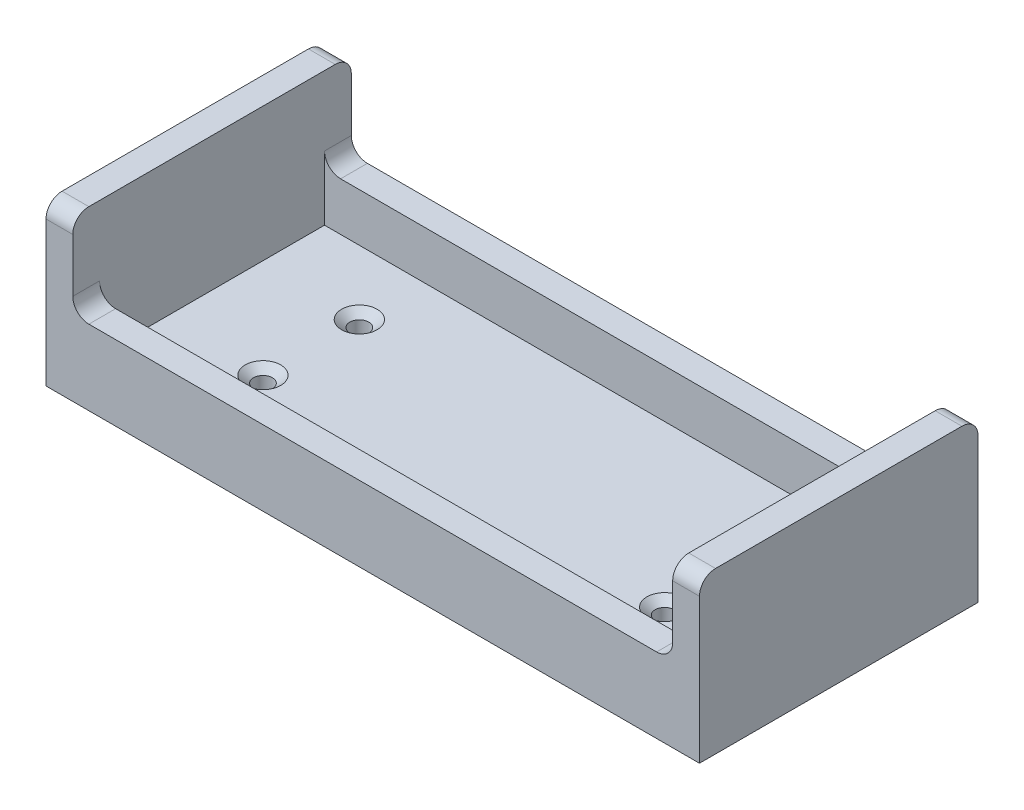
from build123d import *

# Parameters (mm, degrees)
BOSS_EXTRUDE1_DEPTH                               = 38.1
BOSS_EXTRUDE1_2_DEPTH                             = 38.1
SKETCH1_4_W                                       = 142.24
SKETCH1_4_H                                       = 53.34
BOSS_EXTRUDE2_DEPTH                               = 6.35
SKETCH1_5_W                                       = 142.24
SKETCH1_5_H                                       = 6.35
BOSS_EXTRUDE3_DEPTH                               = 17.78
FILLET1_R                                         = 3.81
CSK_FOR_8_FLAT_HEAD_MACHINE_SCREW_100_D           = 4.4958
CSK_FOR_8_FLAT_HEAD_MACHINE_SCREW_100_CSINK_D     = 8.4328
CSK_FOR_8_FLAT_HEAD_MACHINE_SCREW_100_CSINK_ANGLE = 100


with BuildPart() as part:
    # Sketch1 → Boss-Extrude1 (new body)
    with BuildSketch(Plane(origin=(0, 0, 0), x_dir=(1, 0, 0), z_dir=(0, 1, 0))):
        Polygon((72.784549316, 28.417821782), (72.784549316, 22.067821782), (72.784549316, -31.272178218), (72.784549316, -37.622178218), (79.134549316, -37.622178218), (79.134549316, 28.417821782), align=None)
    extrude(amount=BOSS_EXTRUDE1_DEPTH)



with BuildPart() as body_2:
    # Sketch1 → Boss-Extrude1 2 (new body)
    with BuildSketch(Plane(origin=(0, 0, 0), x_dir=(1, 0, 0), z_dir=(0, 1, 0))):
        Polygon((-69.455450684, -31.272178218), (-69.455450684, 22.067821782), (-69.455450684, 28.417821782), (-75.805450684, 28.417821782), (-75.805450684, -37.622178218), (-69.455450684, -37.622178218), align=None)
    extrude(amount=BOSS_EXTRUDE1_2_DEPTH)


with BuildPart() as part_1:
    add(part.part)

    add(body_2.part)  # Boss-Extrude2 merges body 2
    # Sketch1<4> → Boss-Extrude2 (add)
    with BuildSketch(Plane(origin=(0, 0, 0), x_dir=(1, 0, 0), z_dir=(0, 1, 0))):
        with Locations((1.664549316, -4.602178218)):
            Rectangle(SKETCH1_4_W, SKETCH1_4_H)
    extrude(amount=BOSS_EXTRUDE2_DEPTH)

    # Sketch1<5> → Boss-Extrude3 (add)
    with BuildSketch(Plane(origin=(0, 0, 0), x_dir=(1, 0, 0), z_dir=(0, 1, 0))):
        with Locations((1.664549316, 25.242821782)):
            Rectangle(SKETCH1_5_W, SKETCH1_5_H)
        with Locations((1.664549316, -34.447178218)):
            Rectangle(SKETCH1_5_W, SKETCH1_5_H)
    extrude(amount=BOSS_EXTRUDE3_DEPTH)

    # Fillet1
    fillet1_edges = [part_1.edges().sort_by_distance(p)[0] for p in [
        (75.959549316, 38.1, 37.622178218),
        (75.959549316, 38.1, -28.417821782),
        (-72.630450684, 38.1, -28.417821782),
        (-72.630450684, 38.1, 37.622178218),
        (-69.455450684, 17.78, -25.242821782),
        (72.784549316, 17.78, -25.242821782),
        (72.784549316, 17.78, 34.447178218),
        (-69.455450684, 17.78, 34.447178218),
    ]]
    fillet(fillet1_edges, radius=FILLET1_R)

    # CSK for #8 Flat Head Machine Screw (100)2 (through all)
    with Locations(Plane(origin=(0, 6.35, 0), x_dir=(1, 0, 0), z_dir=(0, 1, 0))):
        with Locations((-45.960450684, -16.032178218), (-45.960450684, 6.827821782), (49.289549316, 6.827821782), (49.289549316, -16.032178218)):
            CounterSinkHole(CSK_FOR_8_FLAT_HEAD_MACHINE_SCREW_100_D / 2, CSK_FOR_8_FLAT_HEAD_MACHINE_SCREW_100_CSINK_D / 2, counter_sink_angle=CSK_FOR_8_FLAT_HEAD_MACHINE_SCREW_100_CSINK_ANGLE)


solid = part_1.part
